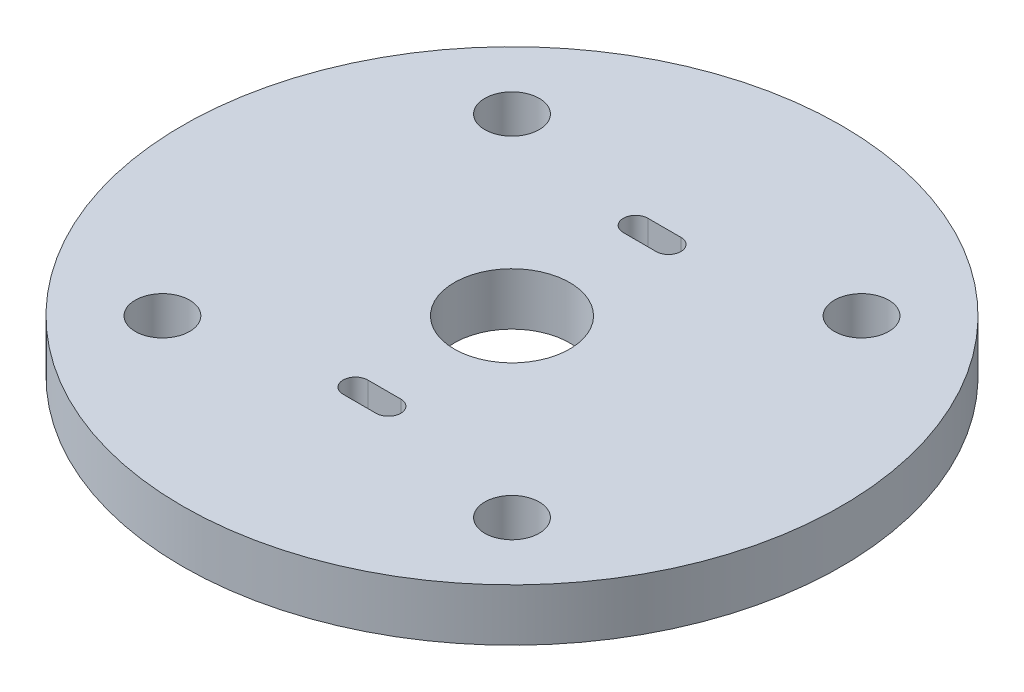
from build123d import *

# Parameters (mm, degrees)
SKETCH1_R           = 20
SKETCH1_R_2         = 3.5
SKETCH1_R_3         = 1.65
BOSS_EXTRUDE1_DEPTH = 3.175
CUT_EXTRUDE1_DEPTH  = 44.400561775


with BuildPart() as part:
    # Sketch1 → Boss-Extrude1 (new body)
    with BuildSketch(Plane(origin=(0, 0, 0), x_dir=(1, 0, 0), z_dir=(0, 1, 0))):
        with Locations(Location((10.606601718, 10.606601718, 0), (0, 0, 270))):
            Circle(SKETCH1_R)
        with Locations(Location((10.606601718, 10.606601718, 0), (0, 0, 270))):
            Circle(SKETCH1_R_2, mode=Mode.SUBTRACT)
        with Locations(Location((0, 21.213203436, 0), (0, 0, 270))):
            Circle(SKETCH1_R_3, mode=Mode.SUBTRACT)
        with Locations(Location((21.213203436, 21.213203436, 0), (0, 0, 270))):
            Circle(SKETCH1_R_3, mode=Mode.SUBTRACT)
        with Locations(Location((21.213203436, 0, 0), (0, 0, 270))):
            Circle(SKETCH1_R_3, mode=Mode.SUBTRACT)
        with Locations(Location((0, 0, 0), (0, 0, 270))):
            Circle(SKETCH1_R_3, mode=Mode.SUBTRACT)
    extrude(amount=BOSS_EXTRUDE1_DEPTH)

    # Sketch2 → Cut-Extrude1 (cut, through all)
    with BuildSketch(Plane(origin=(0, 3.175, 0), x_dir=(1, 0, 0), z_dir=(0, 1, 0))):
        with BuildLine():
            Line((9.606601718, 19.856601736), (11.606601718, 19.856601736))
            ThreePointArc((11.606601718, 19.856601736), (12.356601718, 19.106601736), (11.606601718, 18.356601736))
            Line((11.606601718, 18.356601736), (9.606601718, 18.356601736))
            ThreePointArc((9.606601718, 18.356601736), (8.856601718, 19.106601736), (9.606601718, 19.856601736))
        make_face()
        with BuildLine():
            Line((9.606601718, 1.3566017), (11.606601718, 1.3566017))
            ThreePointArc((11.606601718, 1.3566017), (12.356601718, 2.1066017), (11.606601718, 2.8566017))
            Line((11.606601718, 2.8566017), (9.606601718, 2.8566017))
            ThreePointArc((9.606601718, 2.8566017), (8.856601718, 2.1066017), (9.606601718, 1.3566017))
        make_face()
    extrude(amount=-CUT_EXTRUDE1_DEPTH, mode=Mode.SUBTRACT)


solid = part.part
